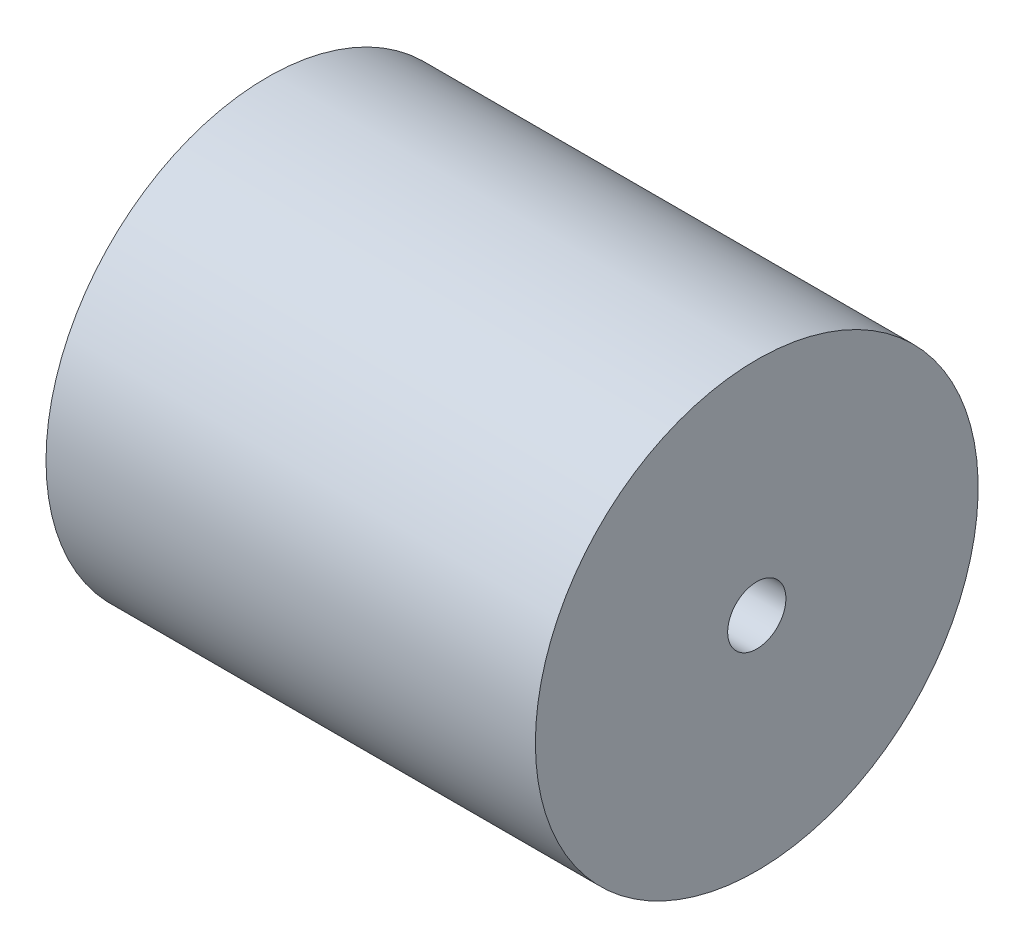
from build123d import *

# Parameters (mm, degrees)
SKETCH1_R           = 9.5
SKETCH1_R_2         = 1.25
BOSS_EXTRUDE1_DEPTH = 21


with BuildPart() as part:
    # Sketch1 → Boss-Extrude1 (new body)
    with BuildSketch(Plane(origin=(0, 0, 0), x_dir=(0, 0, -1), z_dir=(1, 0, 0))):
        with Locations(Location((0, 0, 0), (0, 0, 180))):
            Circle(SKETCH1_R)
        with Locations(Location((0, 0, 0), (0, 0, 180))):
            Circle(SKETCH1_R_2, mode=Mode.SUBTRACT)
    extrude(amount=BOSS_EXTRUDE1_DEPTH)


solid = part.part
